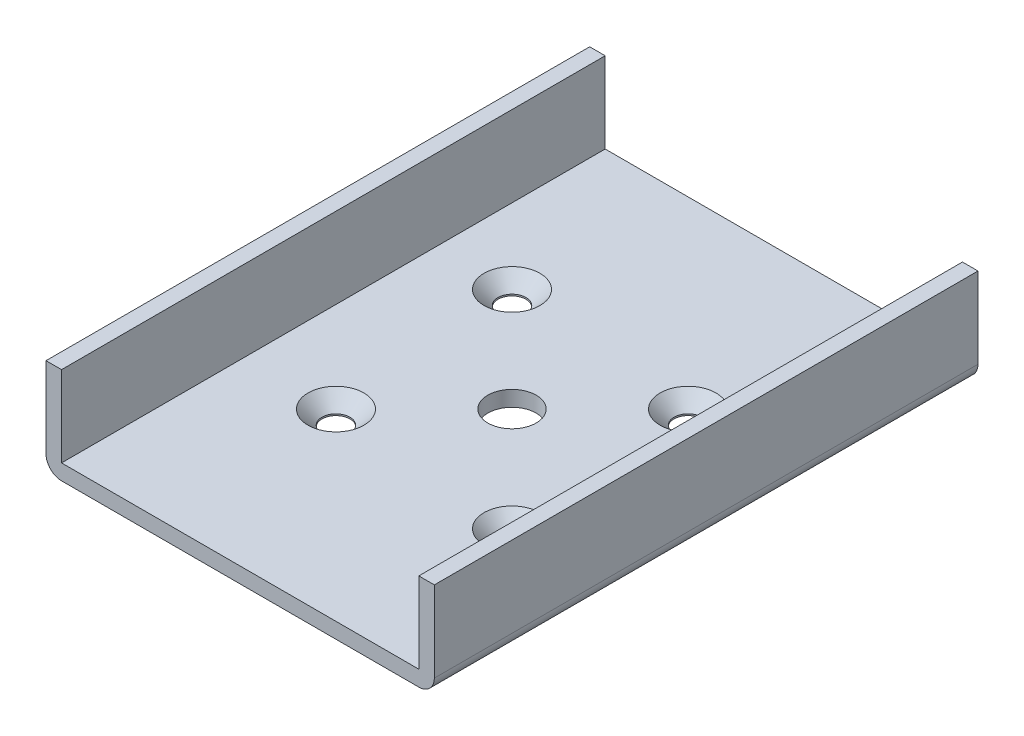
from build123d import *

# Parameters (mm, degrees)
EXTRUDE_THIN1_DEPTH                                  = 35
CUT_EXTRUDE1_REACH                                   = 39.527
SKETCH2_R                                            = 1.55575
CSK_FOR_M1_6_COUNTERSUNK_FLAT_HEAD_SCREW_D           = 1.8
CSK_FOR_M1_6_COUNTERSUNK_FLAT_HEAD_SCREW_DEPTH       = 119
CSK_FOR_M1_6_COUNTERSUNK_FLAT_HEAD_SCREW_CSINK_D     = 3.6
CSK_FOR_M1_6_COUNTERSUNK_FLAT_HEAD_SCREW_CSINK_ANGLE = 90
CSK_FOR_M1_6_COUNTERSUNK_FLAT_HEAD_SCREW_TIP         = 0.540774557


with BuildPart() as part:
    # Sketch1 → Extrude-Thin1 (new body)
    with BuildSketch(Plane.XY):
        with BuildLine():
            Line((-12.5, 6.2), (-12.5, 1))
            ThreePointArc((-12.5, 1), (-12.207106781, 0.292893219), (-11.5, 0))
            Line((-11.5, 0), (11.5, 0))
            ThreePointArc((11.5, 0), (12.207106781, 0.292893219), (12.5, 1))
            Line((12.5, 1), (12.5, 6.2))
            Line((12.5, 6.2), (11.5, 6.2))
            Line((11.5, 6.2), (11.5, 1))
            Line((11.5, 1), (-11.5, 1))
            Line((-11.5, 1), (-11.5, 6.2))
            Line((-11.5, 6.2), (-12.5, 6.2))
        make_face()
    extrude(amount=EXTRUDE_THIN1_DEPTH)

    # Sketch2 → Cut-Extrude1 (cut, up to next)
    with BuildSketch(Plane(origin=(0, 1, 0), x_dir=(1, 0, 0), z_dir=(0, 1, 0)), mode=Mode.PRIVATE) as cut_extrude1_sk1:
        with Locations(Location((0, -17.5, 0), (0, 0, 180))):
            Circle(SKETCH2_R)
    cut_extrude1_tool1 = extrude(cut_extrude1_sk1.sketch, amount=-CUT_EXTRUDE1_REACH, mode=Mode.PRIVATE) & part.part
    add(cut_extrude1_tool1.solids().sort_by_distance((0, 1, 17.5))[0], mode=Mode.SUBTRACT)

    # CSK for M1.6 Countersunk Flat Head Screw1
    with Locations(Plane(origin=(5.666541612, 1, 11.833458388), x_dir=(1, 0, 0), z_dir=(0, 1, 0))):
        with Locations((0, 0), (1.005788686, -12.33887191), (-11.333083224, -11.333083224), (-12.33887191, 1.005788686)):
            CounterSinkHole(CSK_FOR_M1_6_COUNTERSUNK_FLAT_HEAD_SCREW_D / 2, CSK_FOR_M1_6_COUNTERSUNK_FLAT_HEAD_SCREW_CSINK_D / 2, depth=CSK_FOR_M1_6_COUNTERSUNK_FLAT_HEAD_SCREW_DEPTH, counter_sink_angle=CSK_FOR_M1_6_COUNTERSUNK_FLAT_HEAD_SCREW_CSINK_ANGLE)
            with Locations((0, 0, -(CSK_FOR_M1_6_COUNTERSUNK_FLAT_HEAD_SCREW_DEPTH + CSK_FOR_M1_6_COUNTERSUNK_FLAT_HEAD_SCREW_TIP / 2))):  # 118° drill point
                Cone(0, CSK_FOR_M1_6_COUNTERSUNK_FLAT_HEAD_SCREW_D / 2, CSK_FOR_M1_6_COUNTERSUNK_FLAT_HEAD_SCREW_TIP, mode=Mode.SUBTRACT)


solid = part.part
